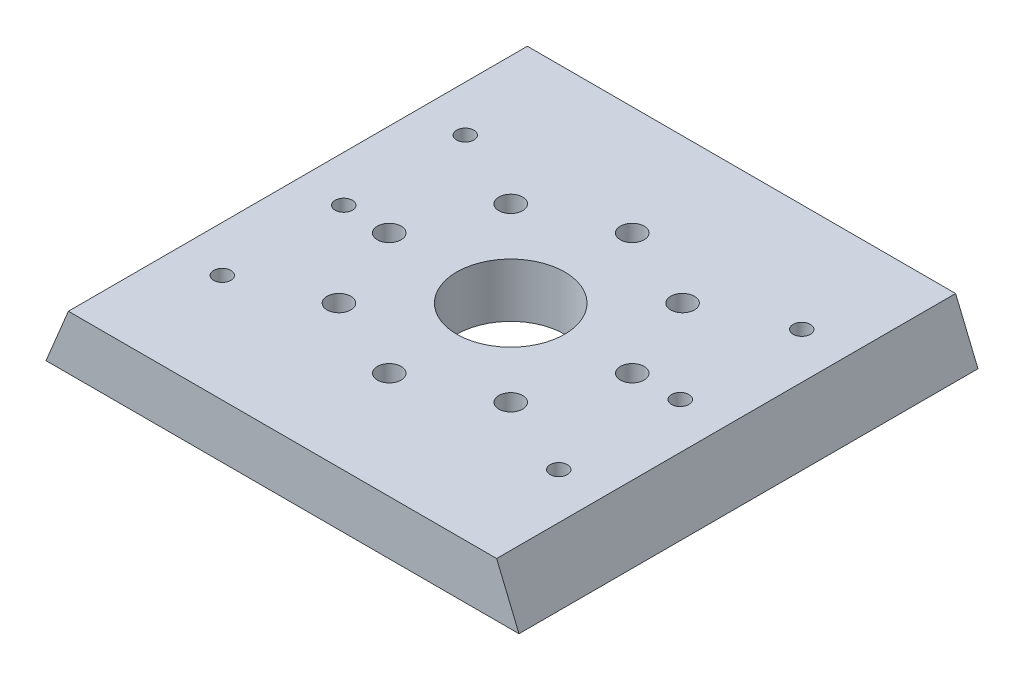
from build123d import *

# Parameters (mm, degrees)
BOSS_EXTRUDE1_DEPTH = 85
SKETCH3_R           = 10
SKETCH3_R_2         = 2.2
CUT_EXTRUDE1_DEPTH  = 85
SKETCH4_R           = 1.6
CUT_EXTRUDE2_DEPTH  = 85


with BuildPart() as part:
    # Sketch2 → Boss-Extrude1 (new body)
    with BuildSketch(Plane.XY):
        Polygon((0, 0), (87.594271247, 0), (83.452135624, 10), (4.142135624, 10), align=None)
    extrude(amount=BOSS_EXTRUDE1_DEPTH)

    # Sketch3 → Cut-Extrude1 (cut)
    with BuildSketch(Plane(origin=(0, 10, 0), x_dir=(1, 0, 0), z_dir=(0, 1, 0))):
        with Locations(Location((43.797135624, -42.734969619, 0), (0, 0, 180))):
            Circle(SKETCH3_R)
        with Locations(Location((43.797135624, -20.234969619, 0), (0, 0, 180))):
            Circle(SKETCH3_R_2)
        with Locations(Location((59.7070382, -26.825067042, 0), (0, 0, 180))):
            Circle(SKETCH3_R_2)
        with Locations(Location((66.297135624, -42.734969619, 0), (0, 0, 180))):
            Circle(SKETCH3_R_2)
        with Locations(Location((59.7070382, -58.644872196, 0), (0, 0, 180))):
            Circle(SKETCH3_R_2)
        with Locations(Location((43.797135624, -65.234969619, 0), (0, 0, 180))):
            Circle(SKETCH3_R_2)
        with Locations(Location((27.887233047, -58.644872196, 0), (0, 0, 180))):
            Circle(SKETCH3_R_2)
        with Locations(Location((21.297135624, -42.734969619, 0), (0, 0, 180))):
            Circle(SKETCH3_R_2)
        with Locations(Location((27.887233047, -26.825067042, 0), (0, 0, 180))):
            Circle(SKETCH3_R_2)
    extrude(amount=-CUT_EXTRUDE1_DEPTH, mode=Mode.SUBTRACT)

    # Sketch4 → Cut-Extrude2 (cut)
    with BuildSketch(Plane(origin=(0, 10, 0), x_dir=(1, 0, 0), z_dir=(0, 1, 0))):
        with Locations(Location((12.642135624, -20, 0), (0, 0, 180))):
            Circle(SKETCH4_R)
        with Locations(Location((12.642135624, -42.5, 0), (0, 0, 180))):
            Circle(SKETCH4_R)
        with Locations(Location((12.642135624, -65, 0), (0, 0, 180))):
            Circle(SKETCH4_R)
        with Locations(Location((74.952135624, -65, 0), (0, 0, 180))):
            Circle(SKETCH4_R)
        with Locations(Location((74.952135624, -42.5, 0), (0, 0, 180))):
            Circle(SKETCH4_R)
        with Locations(Location((74.952135624, -20, 0), (0, 0, 180))):
            Circle(SKETCH4_R)
    extrude(amount=-CUT_EXTRUDE2_DEPTH, mode=Mode.SUBTRACT)


solid = part.part
